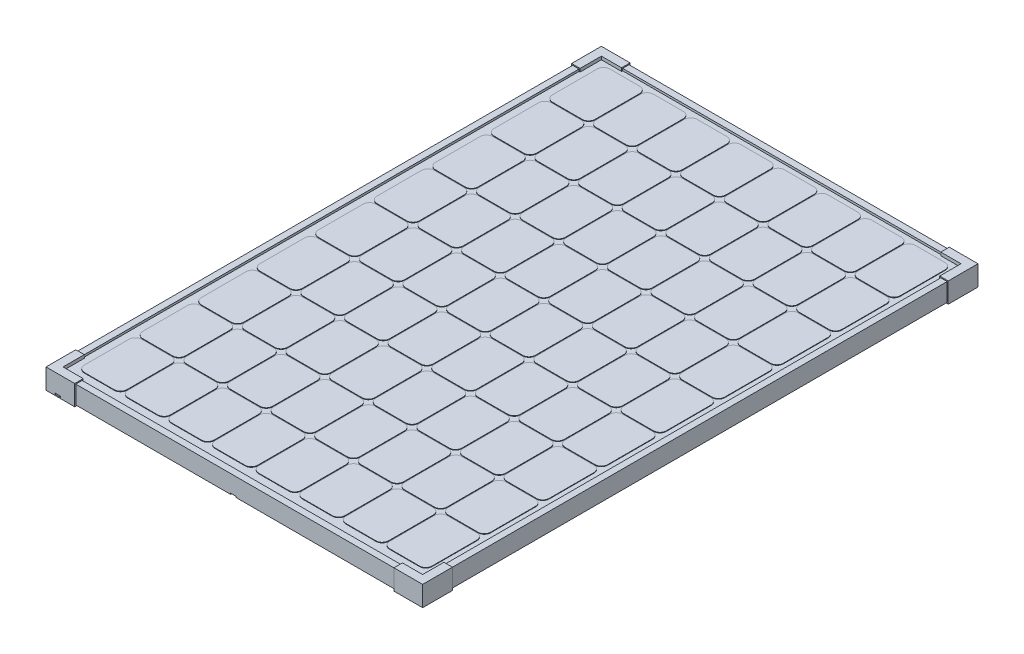
from build123d import *

# Parameters (mm, degrees)
CROQUIS1_W              = 352
CROQUIS1_H              = 520
SALIENTE_EXTRUIR1_DEPTH = 17
CROQUIS3_W              = 340
CROQUIS3_H              = 508
CORTAR_EXTRUIR1_DEPTH   = 2
VACIADO1_T              = -1
CROQUIS2_W              = 352
CROQUIS2_H              = 520
CROQUIS2_W_2            = 318
CROQUIS2_H_2            = 486
SALIENTE_EXTRUIR2_DEPTH = 1
SALIENTE_EXTRUIR3_START = -17
SALIENTE_EXTRUIR3_DEPTH = 18
SALIENTE_EXTRUIR4_DEPTH = 1
SIMETR_A2_START         = -17
SIMETR_A2_COPY_1_DEPTH  = 18
SIMETR_A2_COPY_2_DEPTH  = 1
CORTAR_EXTRUIR2_DEPTH   = 1
MATRIZL1_COUNT          = 2
MATRIZL1_PITCH          = 164
MATRIZL1_COUNT_DIR2     = 2
MATRIZL1_PITCH_DIR2     = 115
CROQUIS7_W              = 50
CROQUIS7_H              = 67
SALIENTE_EXTRUIR5_DEPTH = 14
REDONDEO1_R             = 3
SALIENTE_EXTRUIR6_DEPTH = 0.5


with BuildPart() as part:
    # Croquis1 → Saliente-Extruir1 (new body)
    with BuildSketch(Plane(origin=(0, 0, 0), x_dir=(1, 0, 0), z_dir=(0, 1, 0))):
        with Locations((176, 260)):
            Rectangle(CROQUIS1_W, CROQUIS1_H)
    extrude(amount=SALIENTE_EXTRUIR1_DEPTH)

    # Croquis3 → Cortar-Extruir1 (cut)
    with BuildSketch(Plane(origin=(0, 17, 0), x_dir=(1, 0, 0), z_dir=(0, 1, 0))):
        with Locations((176, 260)):
            Rectangle(CROQUIS3_W, CROQUIS3_H)
    extrude(amount=-CORTAR_EXTRUIR1_DEPTH, mode=Mode.SUBTRACT)

    # Vaciado1
    vaciado1_openings = [part.faces().sort_by_distance(p)[0] for p in [
        (176, 0, -260),
    ]]
    offset(amount=VACIADO1_T, openings=vaciado1_openings, kind=Kind.INTERSECTION)

    # Croquis2 → Saliente-Extruir2 (add)
    with BuildSketch(Plane.XZ):
        with Locations((176, -260)):
            Rectangle(CROQUIS2_W, CROQUIS2_H)
        with Locations((176, -260)):
            Rectangle(CROQUIS2_W_2, CROQUIS2_H_2, mode=Mode.SUBTRACT)
    extrude(amount=-SALIENTE_EXTRUIR2_DEPTH)

    # Croquis4 → Saliente-Extruir3 (add)
    with BuildSketch(Plane(origin=(0, 17, 0), x_dir=(1, 0, 0), z_dir=(0, 1, 0)).offset(SALIENTE_EXTRUIR3_START)):
        Polygon((26, 521), (-1, 521), (-1, 493), (7, 493), (7, 513), (26, 513), align=None)
    saliente_extruir3 = extrude(amount=SALIENTE_EXTRUIR3_DEPTH)

    # Croquis5 → Saliente-Extruir4 (add, symmetric)
    with BuildSketch(Plane.XZ):
        Polygon((-1, -521), (-1, -493), (18, -493), (18, -502), (26, -502), (26, -521), align=None)
    saliente_extruir4 = extrude(amount=SALIENTE_EXTRUIR4_DEPTH, both=True)

    # Simetría1: Saliente-Extruir3, Saliente-Extruir4 across plane
    add(saliente_extruir3.mirror(Plane.XY.offset(-260)))
    add(saliente_extruir4.mirror(Plane.XY.offset(-260)))

    # Simetría2: Saliente-Extruir3, Saliente-Extruir4 across plane
    add(saliente_extruir3.mirror(Plane.ZY.offset(-176)))
    add(saliente_extruir4.mirror(Plane.ZY.offset(-176)))

    # Simetría2 copy 1 sketch → Simetría2 copy 1 (add)
    with BuildSketch(Plane(origin=(352, 17, -520), x_dir=(-1, 0, 0), z_dir=(0, 1, 0)).offset(SIMETR_A2_START)):
        Polygon((26, 521), (-1, 521), (-1, 493), (7, 493), (7, 513), (26, 513), align=None)
    extrude(amount=SIMETR_A2_COPY_1_DEPTH)

    # Simetría2 copy 2 sketch → Simetría2 copy 2 (add, symmetric)
    with BuildSketch(Plane(origin=(352, 0, -520), x_dir=(-1, 0, 0), z_dir=(0, -1, 0))):
        Polygon((-1, -521), (-1, -493), (18, -493), (18, -502), (26, -502), (26, -521), align=None)
    extrude(amount=SIMETR_A2_COPY_2_DEPTH, both=True)

    # Croquis6 → Cortar-Extruir2 (cut)
    with BuildSketch(Plane.XZ):
        with BuildLine():
            Line((7.5, -646.40351795), (7.5, 241.40351795))
            ThreePointArc((7.5, 241.40351795), (10, 243.90351795), (12.5, 241.40351795))
            Line((12.5, 241.40351795), (12.5, -646.40351795))
            ThreePointArc((12.5, -646.40351795), (10, -648.90351795), (7.5, -646.40351795))
        make_face()
    cortar_extruir2 = extrude(amount=-CORTAR_EXTRUIR2_DEPTH, mode=Mode.SUBTRACT)

    # MatrizL1: Cortar-Extruir2 2 × 2
    with Locations(*[(i * MATRIZL1_PITCH, 0, -j * MATRIZL1_PITCH_DIR2) for i in range(MATRIZL1_COUNT) for j in range(MATRIZL1_COUNT_DIR2) if (i, j) != (0, 0)]):
        add(cortar_extruir2, mode=Mode.SUBTRACT)

    # Croquis7 → Saliente-Extruir5 (add)
    with BuildSketch(Plane.XZ.offset(-14)):
        with Locations((259.5, -59.5)):
            Rectangle(CROQUIS7_W, CROQUIS7_H)
    extrude(amount=SALIENTE_EXTRUIR5_DEPTH)

    # Redondeo1
    redondeo1_edges = [part.edges().sort_by_distance(p)[0] for p in [
        (284.5, 7, -93),
        (284.5, 7, -26),
        (234.5, 7, -26),
        (234.5, 7, -93),
    ]]
    fillet(redondeo1_edges, radius=REDONDEO1_R)

    # Croquis8 → Saliente-Extruir6 (add)
    with BuildSketch(Plane(origin=(0, 15, 0), x_dir=(1, 0, 0), z_dir=(0, 1, 0))):
        with BuildLine():
            Line((19, 509), (47, 509))
            ThreePointArc((47, 509), (51.242640687, 507.242640687), (53, 503))
            Line((53, 503), (53, 461))
            ThreePointArc((53, 461), (51.242640687, 456.757359313), (47, 455))
            Line((47, 455), (19, 455))
            ThreePointArc((19, 455), (14.757359313, 456.757359313), (13, 461))
            Line((13, 461), (13, 503))
            ThreePointArc((13, 503), (14.757359313, 507.242640687), (19, 509))
        make_face()
        with BuildLine():
            Line((60, 509), (88, 509))
            ThreePointArc((88, 509), (92.242640687, 507.242640687), (94, 503))
            Line((94, 503), (94, 461))
            ThreePointArc((94, 461), (92.242640687, 456.757359313), (88, 455))
            Line((88, 455), (60, 455))
            ThreePointArc((60, 455), (55.757359313, 456.757359313), (54, 461))
            Line((54, 461), (54, 503))
            ThreePointArc((54, 503), (55.757359313, 507.242640687), (60, 509))
        make_face()
        with BuildLine():
            Line((101, 509), (129, 509))
            ThreePointArc((129, 509), (133.242640687, 507.242640687), (135, 503))
            Line((135, 503), (135, 461))
            ThreePointArc((135, 461), (133.242640687, 456.757359313), (129, 455))
            Line((129, 455), (101, 455))
            ThreePointArc((101, 455), (96.757359313, 456.757359313), (95, 461))
            Line((95, 461), (95, 503))
            ThreePointArc((95, 503), (96.757359313, 507.242640687), (101, 509))
        make_face()
        with BuildLine():
            Line((142, 509), (170, 509))
            ThreePointArc((170, 509), (174.242640687, 507.242640687), (176, 503))
            Line((176, 503), (176, 461))
            ThreePointArc((176, 461), (174.242640687, 456.757359313), (170, 455))
            Line((170, 455), (142, 455))
            ThreePointArc((142, 455), (137.757359313, 456.757359313), (136, 461))
            Line((136, 461), (136, 503))
            ThreePointArc((136, 503), (137.757359313, 507.242640687), (142, 509))
        make_face()
        with BuildLine():
            Line((183, 509), (211, 509))
            ThreePointArc((211, 509), (215.242640687, 507.242640687), (217, 503))
            Line((217, 503), (217, 461))
            ThreePointArc((217, 461), (215.242640687, 456.757359313), (211, 455))
            Line((211, 455), (183, 455))
            ThreePointArc((183, 455), (178.757359313, 456.757359313), (177, 461))
            Line((177, 461), (177, 503))
            ThreePointArc((177, 503), (178.757359313, 507.242640687), (183, 509))
        make_face()
        with BuildLine():
            Line((224, 509), (252, 509))
            ThreePointArc((252, 509), (256.242640687, 507.242640687), (258, 503))
            Line((258, 503), (258, 461))
            ThreePointArc((258, 461), (256.242640687, 456.757359313), (252, 455))
            Line((252, 455), (224, 455))
            ThreePointArc((224, 455), (219.757359313, 456.757359313), (218, 461))
            Line((218, 461), (218, 503))
            ThreePointArc((218, 503), (219.757359313, 507.242640687), (224, 509))
        make_face()
        with BuildLine():
            Line((265, 509), (293, 509))
            ThreePointArc((293, 509), (297.242640687, 507.242640687), (299, 503))
            Line((299, 503), (299, 461))
            ThreePointArc((299, 461), (297.242640687, 456.757359313), (293, 455))
            Line((293, 455), (265, 455))
            ThreePointArc((265, 455), (260.757359313, 456.757359313), (259, 461))
            Line((259, 461), (259, 503))
            ThreePointArc((259, 503), (260.757359313, 507.242640687), (265, 509))
        make_face()
        with BuildLine():
            Line((306, 509), (334, 509))
            ThreePointArc((334, 509), (338.242640687, 507.242640687), (340, 503))
            Line((340, 503), (340, 461))
            ThreePointArc((340, 461), (338.242640687, 456.757359313), (334, 455))
            Line((334, 455), (306, 455))
            ThreePointArc((306, 455), (301.757359313, 456.757359313), (300, 461))
            Line((300, 461), (300, 503))
            ThreePointArc((300, 503), (301.757359313, 507.242640687), (306, 509))
        make_face()
        with BuildLine():
            Line((60, 454), (88, 454))
            ThreePointArc((88, 454), (92.242640687, 452.242640687), (94, 448))
            Line((94, 448), (94, 406))
            ThreePointArc((94, 406), (92.242640687, 401.757359313), (88, 400))
            Line((88, 400), (60, 400))
            ThreePointArc((60, 400), (55.757359313, 401.757359313), (54, 406))
            Line((54, 406), (54, 448))
            ThreePointArc((54, 448), (55.757359313, 452.242640687), (60, 454))
        make_face()
        with BuildLine():
            Line((101, 454), (129, 454))
            ThreePointArc((129, 454), (133.242640687, 452.242640687), (135, 448))
            Line((135, 448), (135, 406))
            ThreePointArc((135, 406), (133.242640687, 401.757359313), (129, 400))
            Line((129, 400), (101, 400))
            ThreePointArc((101, 400), (96.757359313, 401.757359313), (95, 406))
            Line((95, 406), (95, 448))
            ThreePointArc((95, 448), (96.757359313, 452.242640687), (101, 454))
        make_face()
        with BuildLine():
            Line((142, 454), (170, 454))
            ThreePointArc((170, 454), (174.242640687, 452.242640687), (176, 448))
            Line((176, 448), (176, 406))
            ThreePointArc((176, 406), (174.242640687, 401.757359313), (170, 400))
            Line((170, 400), (142, 400))
            ThreePointArc((142, 400), (137.757359313, 401.757359313), (136, 406))
            Line((136, 406), (136, 448))
            ThreePointArc((136, 448), (137.757359313, 452.242640687), (142, 454))
        make_face()
        with BuildLine():
            Line((183, 454), (211, 454))
            ThreePointArc((211, 454), (215.242640687, 452.242640687), (217, 448))
            Line((217, 448), (217, 406))
            ThreePointArc((217, 406), (215.242640687, 401.757359313), (211, 400))
            Line((211, 400), (183, 400))
            ThreePointArc((183, 400), (178.757359313, 401.757359313), (177, 406))
            Line((177, 406), (177, 448))
            ThreePointArc((177, 448), (178.757359313, 452.242640687), (183, 454))
        make_face()
        with BuildLine():
            Line((224, 454), (252, 454))
            ThreePointArc((252, 454), (256.242640687, 452.242640687), (258, 448))
            Line((258, 448), (258, 406))
            ThreePointArc((258, 406), (256.242640687, 401.757359313), (252, 400))
            Line((252, 400), (224, 400))
            ThreePointArc((224, 400), (219.757359313, 401.757359313), (218, 406))
            Line((218, 406), (218, 448))
            ThreePointArc((218, 448), (219.757359313, 452.242640687), (224, 454))
        make_face()
        with BuildLine():
            Line((265, 454), (293, 454))
            ThreePointArc((293, 454), (297.242640687, 452.242640687), (299, 448))
            Line((299, 448), (299, 406))
            ThreePointArc((299, 406), (297.242640687, 401.757359313), (293, 400))
            Line((293, 400), (265, 400))
            ThreePointArc((265, 400), (260.757359313, 401.757359313), (259, 406))
            Line((259, 406), (259, 448))
            ThreePointArc((259, 448), (260.757359313, 452.242640687), (265, 454))
        make_face()
        with BuildLine():
            Line((306, 454), (334, 454))
            ThreePointArc((334, 454), (338.242640687, 452.242640687), (340, 448))
            Line((340, 448), (340, 406))
            ThreePointArc((340, 406), (338.242640687, 401.757359313), (334, 400))
            Line((334, 400), (306, 400))
            ThreePointArc((306, 400), (301.757359313, 401.757359313), (300, 406))
            Line((300, 406), (300, 448))
            ThreePointArc((300, 448), (301.757359313, 452.242640687), (306, 454))
        make_face()
        with BuildLine():
            Line((60, 399), (88, 399))
            ThreePointArc((88, 399), (92.242640687, 397.242640687), (94, 393))
            Line((94, 393), (94, 351))
            ThreePointArc((94, 351), (92.242640687, 346.757359313), (88, 345))
            Line((88, 345), (60, 345))
            ThreePointArc((60, 345), (55.757359313, 346.757359313), (54, 351))
            Line((54, 351), (54, 393))
            ThreePointArc((54, 393), (55.757359313, 397.242640687), (60, 399))
        make_face()
        with BuildLine():
            Line((101, 399), (129, 399))
            ThreePointArc((129, 399), (133.242640687, 397.242640687), (135, 393))
            Line((135, 393), (135, 351))
            ThreePointArc((135, 351), (133.242640687, 346.757359313), (129, 345))
            Line((129, 345), (101, 345))
            ThreePointArc((101, 345), (96.757359313, 346.757359313), (95, 351))
            Line((95, 351), (95, 393))
            ThreePointArc((95, 393), (96.757359313, 397.242640687), (101, 399))
        make_face()
        with BuildLine():
            Line((142, 399), (170, 399))
            ThreePointArc((170, 399), (174.242640687, 397.242640687), (176, 393))
            Line((176, 393), (176, 351))
            ThreePointArc((176, 351), (174.242640687, 346.757359313), (170, 345))
            Line((170, 345), (142, 345))
            ThreePointArc((142, 345), (137.757359313, 346.757359313), (136, 351))
            Line((136, 351), (136, 393))
            ThreePointArc((136, 393), (137.757359313, 397.242640687), (142, 399))
        make_face()
        with BuildLine():
            Line((183, 399), (211, 399))
            ThreePointArc((211, 399), (215.242640687, 397.242640687), (217, 393))
            Line((217, 393), (217, 351))
            ThreePointArc((217, 351), (215.242640687, 346.757359313), (211, 345))
            Line((211, 345), (183, 345))
            ThreePointArc((183, 345), (178.757359313, 346.757359313), (177, 351))
            Line((177, 351), (177, 393))
            ThreePointArc((177, 393), (178.757359313, 397.242640687), (183, 399))
        make_face()
        with BuildLine():
            Line((224, 399), (252, 399))
            ThreePointArc((252, 399), (256.242640687, 397.242640687), (258, 393))
            Line((258, 393), (258, 351))
            ThreePointArc((258, 351), (256.242640687, 346.757359313), (252, 345))
            Line((252, 345), (224, 345))
            ThreePointArc((224, 345), (219.757359313, 346.757359313), (218, 351))
            Line((218, 351), (218, 393))
            ThreePointArc((218, 393), (219.757359313, 397.242640687), (224, 399))
        make_face()
        with BuildLine():
            Line((265, 399), (293, 399))
            ThreePointArc((293, 399), (297.242640687, 397.242640687), (299, 393))
            Line((299, 393), (299, 351))
            ThreePointArc((299, 351), (297.242640687, 346.757359313), (293, 345))
            Line((293, 345), (265, 345))
            ThreePointArc((265, 345), (260.757359313, 346.757359313), (259, 351))
            Line((259, 351), (259, 393))
            ThreePointArc((259, 393), (260.757359313, 397.242640687), (265, 399))
        make_face()
        with BuildLine():
            Line((306, 399), (334, 399))
            ThreePointArc((334, 399), (338.242640687, 397.242640687), (340, 393))
            Line((340, 393), (340, 351))
            ThreePointArc((340, 351), (338.242640687, 346.757359313), (334, 345))
            Line((334, 345), (306, 345))
            ThreePointArc((306, 345), (301.757359313, 346.757359313), (300, 351))
            Line((300, 351), (300, 393))
            ThreePointArc((300, 393), (301.757359313, 397.242640687), (306, 399))
        make_face()
        with BuildLine():
            Line((60, 344), (88, 344))
            ThreePointArc((88, 344), (92.242640687, 342.242640687), (94, 338))
            Line((94, 338), (94, 296))
            ThreePointArc((94, 296), (92.242640687, 291.757359313), (88, 290))
            Line((88, 290), (60, 290))
            ThreePointArc((60, 290), (55.757359313, 291.757359313), (54, 296))
            Line((54, 296), (54, 338))
            ThreePointArc((54, 338), (55.757359313, 342.242640687), (60, 344))
        make_face()
        with BuildLine():
            Line((101, 344), (129, 344))
            ThreePointArc((129, 344), (133.242640687, 342.242640687), (135, 338))
            Line((135, 338), (135, 296))
            ThreePointArc((135, 296), (133.242640687, 291.757359313), (129, 290))
            Line((129, 290), (101, 290))
            ThreePointArc((101, 290), (96.757359313, 291.757359313), (95, 296))
            Line((95, 296), (95, 338))
            ThreePointArc((95, 338), (96.757359313, 342.242640687), (101, 344))
        make_face()
        with BuildLine():
            Line((142, 344), (170, 344))
            ThreePointArc((170, 344), (174.242640687, 342.242640687), (176, 338))
            Line((176, 338), (176, 296))
            ThreePointArc((176, 296), (174.242640687, 291.757359313), (170, 290))
            Line((170, 290), (142, 290))
            ThreePointArc((142, 290), (137.757359313, 291.757359313), (136, 296))
            Line((136, 296), (136, 338))
            ThreePointArc((136, 338), (137.757359313, 342.242640687), (142, 344))
        make_face()
        with BuildLine():
            Line((183, 344), (211, 344))
            ThreePointArc((211, 344), (215.242640687, 342.242640687), (217, 338))
            Line((217, 338), (217, 296))
            ThreePointArc((217, 296), (215.242640687, 291.757359313), (211, 290))
            Line((211, 290), (183, 290))
            ThreePointArc((183, 290), (178.757359313, 291.757359313), (177, 296))
            Line((177, 296), (177, 338))
            ThreePointArc((177, 338), (178.757359313, 342.242640687), (183, 344))
        make_face()
        with BuildLine():
            Line((224, 344), (252, 344))
            ThreePointArc((252, 344), (256.242640687, 342.242640687), (258, 338))
            Line((258, 338), (258, 296))
            ThreePointArc((258, 296), (256.242640687, 291.757359313), (252, 290))
            Line((252, 290), (224, 290))
            ThreePointArc((224, 290), (219.757359313, 291.757359313), (218, 296))
            Line((218, 296), (218, 338))
            ThreePointArc((218, 338), (219.757359313, 342.242640687), (224, 344))
        make_face()
        with BuildLine():
            Line((265, 344), (293, 344))
            ThreePointArc((293, 344), (297.242640687, 342.242640687), (299, 338))
            Line((299, 338), (299, 296))
            ThreePointArc((299, 296), (297.242640687, 291.757359313), (293, 290))
            Line((293, 290), (265, 290))
            ThreePointArc((265, 290), (260.757359313, 291.757359313), (259, 296))
            Line((259, 296), (259, 338))
            ThreePointArc((259, 338), (260.757359313, 342.242640687), (265, 344))
        make_face()
        with BuildLine():
            Line((306, 344), (334, 344))
            ThreePointArc((334, 344), (338.242640687, 342.242640687), (340, 338))
            Line((340, 338), (340, 296))
            ThreePointArc((340, 296), (338.242640687, 291.757359313), (334, 290))
            Line((334, 290), (306, 290))
            ThreePointArc((306, 290), (301.757359313, 291.757359313), (300, 296))
            Line((300, 296), (300, 338))
            ThreePointArc((300, 338), (301.757359313, 342.242640687), (306, 344))
        make_face()
        with BuildLine():
            Line((60, 289), (88, 289))
            ThreePointArc((88, 289), (92.242640687, 287.242640687), (94, 283))
            Line((94, 283), (94, 241))
            ThreePointArc((94, 241), (92.242640687, 236.757359313), (88, 235))
            Line((88, 235), (60, 235))
            ThreePointArc((60, 235), (55.757359313, 236.757359313), (54, 241))
            Line((54, 241), (54, 283))
            ThreePointArc((54, 283), (55.757359313, 287.242640687), (60, 289))
        make_face()
        with BuildLine():
            Line((101, 289), (129, 289))
            ThreePointArc((129, 289), (133.242640687, 287.242640687), (135, 283))
            Line((135, 283), (135, 241))
            ThreePointArc((135, 241), (133.242640687, 236.757359313), (129, 235))
            Line((129, 235), (101, 235))
            ThreePointArc((101, 235), (96.757359313, 236.757359313), (95, 241))
            Line((95, 241), (95, 283))
            ThreePointArc((95, 283), (96.757359313, 287.242640687), (101, 289))
        make_face()
        with BuildLine():
            Line((142, 289), (170, 289))
            ThreePointArc((170, 289), (174.242640687, 287.242640687), (176, 283))
            Line((176, 283), (176, 241))
            ThreePointArc((176, 241), (174.242640687, 236.757359313), (170, 235))
            Line((170, 235), (142, 235))
            ThreePointArc((142, 235), (137.757359313, 236.757359313), (136, 241))
            Line((136, 241), (136, 283))
            ThreePointArc((136, 283), (137.757359313, 287.242640687), (142, 289))
        make_face()
        with BuildLine():
            Line((183, 289), (211, 289))
            ThreePointArc((211, 289), (215.242640687, 287.242640687), (217, 283))
            Line((217, 283), (217, 241))
            ThreePointArc((217, 241), (215.242640687, 236.757359313), (211, 235))
            Line((211, 235), (183, 235))
            ThreePointArc((183, 235), (178.757359313, 236.757359313), (177, 241))
            Line((177, 241), (177, 283))
            ThreePointArc((177, 283), (178.757359313, 287.242640687), (183, 289))
        make_face()
        with BuildLine():
            Line((224, 289), (252, 289))
            ThreePointArc((252, 289), (256.242640687, 287.242640687), (258, 283))
            Line((258, 283), (258, 241))
            ThreePointArc((258, 241), (256.242640687, 236.757359313), (252, 235))
            Line((252, 235), (224, 235))
            ThreePointArc((224, 235), (219.757359313, 236.757359313), (218, 241))
            Line((218, 241), (218, 283))
            ThreePointArc((218, 283), (219.757359313, 287.242640687), (224, 289))
        make_face()
        with BuildLine():
            Line((265, 289), (293, 289))
            ThreePointArc((293, 289), (297.242640687, 287.242640687), (299, 283))
            Line((299, 283), (299, 241))
            ThreePointArc((299, 241), (297.242640687, 236.757359313), (293, 235))
            Line((293, 235), (265, 235))
            ThreePointArc((265, 235), (260.757359313, 236.757359313), (259, 241))
            Line((259, 241), (259, 283))
            ThreePointArc((259, 283), (260.757359313, 287.242640687), (265, 289))
        make_face()
        with BuildLine():
            Line((306, 289), (334, 289))
            ThreePointArc((334, 289), (338.242640687, 287.242640687), (340, 283))
            Line((340, 283), (340, 241))
            ThreePointArc((340, 241), (338.242640687, 236.757359313), (334, 235))
            Line((334, 235), (306, 235))
            ThreePointArc((306, 235), (301.757359313, 236.757359313), (300, 241))
            Line((300, 241), (300, 283))
            ThreePointArc((300, 283), (301.757359313, 287.242640687), (306, 289))
        make_face()
        with BuildLine():
            Line((60, 234), (88, 234))
            ThreePointArc((88, 234), (92.242640687, 232.242640687), (94, 228))
            Line((94, 228), (94, 186))
            ThreePointArc((94, 186), (92.242640687, 181.757359313), (88, 180))
            Line((88, 180), (60, 180))
            ThreePointArc((60, 180), (55.757359313, 181.757359313), (54, 186))
            Line((54, 186), (54, 228))
            ThreePointArc((54, 228), (55.757359313, 232.242640687), (60, 234))
        make_face()
        with BuildLine():
            Line((101, 234), (129, 234))
            ThreePointArc((129, 234), (133.242640687, 232.242640687), (135, 228))
            Line((135, 228), (135, 186))
            ThreePointArc((135, 186), (133.242640687, 181.757359313), (129, 180))
            Line((129, 180), (101, 180))
            ThreePointArc((101, 180), (96.757359313, 181.757359313), (95, 186))
            Line((95, 186), (95, 228))
            ThreePointArc((95, 228), (96.757359313, 232.242640687), (101, 234))
        make_face()
        with BuildLine():
            Line((142, 234), (170, 234))
            ThreePointArc((170, 234), (174.242640687, 232.242640687), (176, 228))
            Line((176, 228), (176, 186))
            ThreePointArc((176, 186), (174.242640687, 181.757359313), (170, 180))
            Line((170, 180), (142, 180))
            ThreePointArc((142, 180), (137.757359313, 181.757359313), (136, 186))
            Line((136, 186), (136, 228))
            ThreePointArc((136, 228), (137.757359313, 232.242640687), (142, 234))
        make_face()
        with BuildLine():
            Line((183, 234), (211, 234))
            ThreePointArc((211, 234), (215.242640687, 232.242640687), (217, 228))
            Line((217, 228), (217, 186))
            ThreePointArc((217, 186), (215.242640687, 181.757359313), (211, 180))
            Line((211, 180), (183, 180))
            ThreePointArc((183, 180), (178.757359313, 181.757359313), (177, 186))
            Line((177, 186), (177, 228))
            ThreePointArc((177, 228), (178.757359313, 232.242640687), (183, 234))
        make_face()
        with BuildLine():
            Line((224, 234), (252, 234))
            ThreePointArc((252, 234), (256.242640687, 232.242640687), (258, 228))
            Line((258, 228), (258, 186))
            ThreePointArc((258, 186), (256.242640687, 181.757359313), (252, 180))
            Line((252, 180), (224, 180))
            ThreePointArc((224, 180), (219.757359313, 181.757359313), (218, 186))
            Line((218, 186), (218, 228))
            ThreePointArc((218, 228), (219.757359313, 232.242640687), (224, 234))
        make_face()
        with BuildLine():
            Line((265, 234), (293, 234))
            ThreePointArc((293, 234), (297.242640687, 232.242640687), (299, 228))
            Line((299, 228), (299, 186))
            ThreePointArc((299, 186), (297.242640687, 181.757359313), (293, 180))
            Line((293, 180), (265, 180))
            ThreePointArc((265, 180), (260.757359313, 181.757359313), (259, 186))
            Line((259, 186), (259, 228))
            ThreePointArc((259, 228), (260.757359313, 232.242640687), (265, 234))
        make_face()
        with BuildLine():
            Line((306, 234), (334, 234))
            ThreePointArc((334, 234), (338.242640687, 232.242640687), (340, 228))
            Line((340, 228), (340, 186))
            ThreePointArc((340, 186), (338.242640687, 181.757359313), (334, 180))
            Line((334, 180), (306, 180))
            ThreePointArc((306, 180), (301.757359313, 181.757359313), (300, 186))
            Line((300, 186), (300, 228))
            ThreePointArc((300, 228), (301.757359313, 232.242640687), (306, 234))
        make_face()
        with BuildLine():
            Line((60, 179), (88, 179))
            ThreePointArc((88, 179), (92.242640687, 177.242640687), (94, 173))
            Line((94, 173), (94, 131))
            ThreePointArc((94, 131), (92.242640687, 126.757359313), (88, 125))
            Line((88, 125), (60, 125))
            ThreePointArc((60, 125), (55.757359313, 126.757359313), (54, 131))
            Line((54, 131), (54, 173))
            ThreePointArc((54, 173), (55.757359313, 177.242640687), (60, 179))
        make_face()
        with BuildLine():
            Line((101, 179), (129, 179))
            ThreePointArc((129, 179), (133.242640687, 177.242640687), (135, 173))
            Line((135, 173), (135, 131))
            ThreePointArc((135, 131), (133.242640687, 126.757359313), (129, 125))
            Line((129, 125), (101, 125))
            ThreePointArc((101, 125), (96.757359313, 126.757359313), (95, 131))
            Line((95, 131), (95, 173))
            ThreePointArc((95, 173), (96.757359313, 177.242640687), (101, 179))
        make_face()
        with BuildLine():
            Line((142, 179), (170, 179))
            ThreePointArc((170, 179), (174.242640687, 177.242640687), (176, 173))
            Line((176, 173), (176, 131))
            ThreePointArc((176, 131), (174.242640687, 126.757359313), (170, 125))
            Line((170, 125), (142, 125))
            ThreePointArc((142, 125), (137.757359313, 126.757359313), (136, 131))
            Line((136, 131), (136, 173))
            ThreePointArc((136, 173), (137.757359313, 177.242640687), (142, 179))
        make_face()
        with BuildLine():
            Line((183, 179), (211, 179))
            ThreePointArc((211, 179), (215.242640687, 177.242640687), (217, 173))
            Line((217, 173), (217, 131))
            ThreePointArc((217, 131), (215.242640687, 126.757359313), (211, 125))
            Line((211, 125), (183, 125))
            ThreePointArc((183, 125), (178.757359313, 126.757359313), (177, 131))
            Line((177, 131), (177, 173))
            ThreePointArc((177, 173), (178.757359313, 177.242640687), (183, 179))
        make_face()
        with BuildLine():
            Line((224, 179), (252, 179))
            ThreePointArc((252, 179), (256.242640687, 177.242640687), (258, 173))
            Line((258, 173), (258, 131))
            ThreePointArc((258, 131), (256.242640687, 126.757359313), (252, 125))
            Line((252, 125), (224, 125))
            ThreePointArc((224, 125), (219.757359313, 126.757359313), (218, 131))
            Line((218, 131), (218, 173))
            ThreePointArc((218, 173), (219.757359313, 177.242640687), (224, 179))
        make_face()
        with BuildLine():
            Line((265, 179), (293, 179))
            ThreePointArc((293, 179), (297.242640687, 177.242640687), (299, 173))
            Line((299, 173), (299, 131))
            ThreePointArc((299, 131), (297.242640687, 126.757359313), (293, 125))
            Line((293, 125), (265, 125))
            ThreePointArc((265, 125), (260.757359313, 126.757359313), (259, 131))
            Line((259, 131), (259, 173))
            ThreePointArc((259, 173), (260.757359313, 177.242640687), (265, 179))
        make_face()
        with BuildLine():
            Line((306, 179), (334, 179))
            ThreePointArc((334, 179), (338.242640687, 177.242640687), (340, 173))
            Line((340, 173), (340, 131))
            ThreePointArc((340, 131), (338.242640687, 126.757359313), (334, 125))
            Line((334, 125), (306, 125))
            ThreePointArc((306, 125), (301.757359313, 126.757359313), (300, 131))
            Line((300, 131), (300, 173))
            ThreePointArc((300, 173), (301.757359313, 177.242640687), (306, 179))
        make_face()
        with BuildLine():
            Line((60, 124), (88, 124))
            ThreePointArc((88, 124), (92.242640687, 122.242640687), (94, 118))
            Line((94, 118), (94, 76))
            ThreePointArc((94, 76), (92.242640687, 71.757359313), (88, 70))
            Line((88, 70), (60, 70))
            ThreePointArc((60, 70), (55.757359313, 71.757359313), (54, 76))
            Line((54, 76), (54, 118))
            ThreePointArc((54, 118), (55.757359313, 122.242640687), (60, 124))
        make_face()
        with BuildLine():
            Line((101, 124), (129, 124))
            ThreePointArc((129, 124), (133.242640687, 122.242640687), (135, 118))
            Line((135, 118), (135, 76))
            ThreePointArc((135, 76), (133.242640687, 71.757359313), (129, 70))
            Line((129, 70), (101, 70))
            ThreePointArc((101, 70), (96.757359313, 71.757359313), (95, 76))
            Line((95, 76), (95, 118))
            ThreePointArc((95, 118), (96.757359313, 122.242640687), (101, 124))
        make_face()
        with BuildLine():
            Line((142, 124), (170, 124))
            ThreePointArc((170, 124), (174.242640687, 122.242640687), (176, 118))
            Line((176, 118), (176, 76))
            ThreePointArc((176, 76), (174.242640687, 71.757359313), (170, 70))
            Line((170, 70), (142, 70))
            ThreePointArc((142, 70), (137.757359313, 71.757359313), (136, 76))
            Line((136, 76), (136, 118))
            ThreePointArc((136, 118), (137.757359313, 122.242640687), (142, 124))
        make_face()
        with BuildLine():
            Line((183, 124), (211, 124))
            ThreePointArc((211, 124), (215.242640687, 122.242640687), (217, 118))
            Line((217, 118), (217, 76))
            ThreePointArc((217, 76), (215.242640687, 71.757359313), (211, 70))
            Line((211, 70), (183, 70))
            ThreePointArc((183, 70), (178.757359313, 71.757359313), (177, 76))
            Line((177, 76), (177, 118))
            ThreePointArc((177, 118), (178.757359313, 122.242640687), (183, 124))
        make_face()
        with BuildLine():
            Line((224, 124), (252, 124))
            ThreePointArc((252, 124), (256.242640687, 122.242640687), (258, 118))
            Line((258, 118), (258, 76))
            ThreePointArc((258, 76), (256.242640687, 71.757359313), (252, 70))
            Line((252, 70), (224, 70))
            ThreePointArc((224, 70), (219.757359313, 71.757359313), (218, 76))
            Line((218, 76), (218, 118))
            ThreePointArc((218, 118), (219.757359313, 122.242640687), (224, 124))
        make_face()
        with BuildLine():
            Line((265, 124), (293, 124))
            ThreePointArc((293, 124), (297.242640687, 122.242640687), (299, 118))
            Line((299, 118), (299, 76))
            ThreePointArc((299, 76), (297.242640687, 71.757359313), (293, 70))
            Line((293, 70), (265, 70))
            ThreePointArc((265, 70), (260.757359313, 71.757359313), (259, 76))
            Line((259, 76), (259, 118))
            ThreePointArc((259, 118), (260.757359313, 122.242640687), (265, 124))
        make_face()
        with BuildLine():
            Line((306, 124), (334, 124))
            ThreePointArc((334, 124), (338.242640687, 122.242640687), (340, 118))
            Line((340, 118), (340, 76))
            ThreePointArc((340, 76), (338.242640687, 71.757359313), (334, 70))
            Line((334, 70), (306, 70))
            ThreePointArc((306, 70), (301.757359313, 71.757359313), (300, 76))
            Line((300, 76), (300, 118))
            ThreePointArc((300, 118), (301.757359313, 122.242640687), (306, 124))
        make_face()
        with BuildLine():
            Line((60, 69), (88, 69))
            ThreePointArc((88, 69), (92.242640687, 67.242640687), (94, 63))
            Line((94, 63), (94, 21))
            ThreePointArc((94, 21), (92.242640687, 16.757359313), (88, 15))
            Line((88, 15), (60, 15))
            ThreePointArc((60, 15), (55.757359313, 16.757359313), (54, 21))
            Line((54, 21), (54, 63))
            ThreePointArc((54, 63), (55.757359313, 67.242640687), (60, 69))
        make_face()
        with BuildLine():
            Line((101, 69), (129, 69))
            ThreePointArc((129, 69), (133.242640687, 67.242640687), (135, 63))
            Line((135, 63), (135, 21))
            ThreePointArc((135, 21), (133.242640687, 16.757359313), (129, 15))
            Line((129, 15), (101, 15))
            ThreePointArc((101, 15), (96.757359313, 16.757359313), (95, 21))
            Line((95, 21), (95, 63))
            ThreePointArc((95, 63), (96.757359313, 67.242640687), (101, 69))
        make_face()
        with BuildLine():
            Line((142, 69), (170, 69))
            ThreePointArc((170, 69), (174.242640687, 67.242640687), (176, 63))
            Line((176, 63), (176, 21))
            ThreePointArc((176, 21), (174.242640687, 16.757359313), (170, 15))
            Line((170, 15), (142, 15))
            ThreePointArc((142, 15), (137.757359313, 16.757359313), (136, 21))
            Line((136, 21), (136, 63))
            ThreePointArc((136, 63), (137.757359313, 67.242640687), (142, 69))
        make_face()
        with BuildLine():
            Line((183, 69), (211, 69))
            ThreePointArc((211, 69), (215.242640687, 67.242640687), (217, 63))
            Line((217, 63), (217, 21))
            ThreePointArc((217, 21), (215.242640687, 16.757359313), (211, 15))
            Line((211, 15), (183, 15))
            ThreePointArc((183, 15), (178.757359313, 16.757359313), (177, 21))
            Line((177, 21), (177, 63))
            ThreePointArc((177, 63), (178.757359313, 67.242640687), (183, 69))
        make_face()
        with BuildLine():
            Line((224, 69), (252, 69))
            ThreePointArc((252, 69), (256.242640687, 67.242640687), (258, 63))
            Line((258, 63), (258, 21))
            ThreePointArc((258, 21), (256.242640687, 16.757359313), (252, 15))
            Line((252, 15), (224, 15))
            ThreePointArc((224, 15), (219.757359313, 16.757359313), (218, 21))
            Line((218, 21), (218, 63))
            ThreePointArc((218, 63), (219.757359313, 67.242640687), (224, 69))
        make_face()
        with BuildLine():
            Line((265, 69), (293, 69))
            ThreePointArc((293, 69), (297.242640687, 67.242640687), (299, 63))
            Line((299, 63), (299, 21))
            ThreePointArc((299, 21), (297.242640687, 16.757359313), (293, 15))
            Line((293, 15), (265, 15))
            ThreePointArc((265, 15), (260.757359313, 16.757359313), (259, 21))
            Line((259, 21), (259, 63))
            ThreePointArc((259, 63), (260.757359313, 67.242640687), (265, 69))
        make_face()
        with BuildLine():
            Line((306, 69), (334, 69))
            ThreePointArc((334, 69), (338.242640687, 67.242640687), (340, 63))
            Line((340, 63), (340, 21))
            ThreePointArc((340, 21), (338.242640687, 16.757359313), (334, 15))
            Line((334, 15), (306, 15))
            ThreePointArc((306, 15), (301.757359313, 16.757359313), (300, 21))
            Line((300, 21), (300, 63))
            ThreePointArc((300, 63), (301.757359313, 67.242640687), (306, 69))
        make_face()
        with BuildLine():
            Line((19, 454), (47, 454))
            ThreePointArc((47, 454), (51.242640687, 452.242640687), (53, 448))
            Line((53, 448), (53, 406))
            ThreePointArc((53, 406), (51.242640687, 401.757359313), (47, 400))
            Line((47, 400), (19, 400))
            ThreePointArc((19, 400), (14.757359313, 401.757359313), (13, 406))
            Line((13, 406), (13, 448))
            ThreePointArc((13, 448), (14.757359313, 452.242640687), (19, 454))
        make_face()
        with BuildLine():
            Line((19, 399), (47, 399))
            ThreePointArc((47, 399), (51.242640687, 397.242640687), (53, 393))
            Line((53, 393), (53, 351))
            ThreePointArc((53, 351), (51.242640687, 346.757359313), (47, 345))
            Line((47, 345), (19, 345))
            ThreePointArc((19, 345), (14.757359313, 346.757359313), (13, 351))
            Line((13, 351), (13, 393))
            ThreePointArc((13, 393), (14.757359313, 397.242640687), (19, 399))
        make_face()
        with BuildLine():
            Line((19, 344), (47, 344))
            ThreePointArc((47, 344), (51.242640687, 342.242640687), (53, 338))
            Line((53, 338), (53, 296))
            ThreePointArc((53, 296), (51.242640687, 291.757359313), (47, 290))
            Line((47, 290), (19, 290))
            ThreePointArc((19, 290), (14.757359313, 291.757359313), (13, 296))
            Line((13, 296), (13, 338))
            ThreePointArc((13, 338), (14.757359313, 342.242640687), (19, 344))
        make_face()
        with BuildLine():
            Line((19, 289), (47, 289))
            ThreePointArc((47, 289), (51.242640687, 287.242640687), (53, 283))
            Line((53, 283), (53, 241))
            ThreePointArc((53, 241), (51.242640687, 236.757359313), (47, 235))
            Line((47, 235), (19, 235))
            ThreePointArc((19, 235), (14.757359313, 236.757359313), (13, 241))
            Line((13, 241), (13, 283))
            ThreePointArc((13, 283), (14.757359313, 287.242640687), (19, 289))
        make_face()
        with BuildLine():
            Line((19, 234), (47, 234))
            ThreePointArc((47, 234), (51.242640687, 232.242640687), (53, 228))
            Line((53, 228), (53, 186))
            ThreePointArc((53, 186), (51.242640687, 181.757359313), (47, 180))
            Line((47, 180), (19, 180))
            ThreePointArc((19, 180), (14.757359313, 181.757359313), (13, 186))
            Line((13, 186), (13, 228))
            ThreePointArc((13, 228), (14.757359313, 232.242640687), (19, 234))
        make_face()
        with BuildLine():
            Line((19, 179), (47, 179))
            ThreePointArc((47, 179), (51.242640687, 177.242640687), (53, 173))
            Line((53, 173), (53, 131))
            ThreePointArc((53, 131), (51.242640687, 126.757359313), (47, 125))
            Line((47, 125), (19, 125))
            ThreePointArc((19, 125), (14.757359313, 126.757359313), (13, 131))
            Line((13, 131), (13, 173))
            ThreePointArc((13, 173), (14.757359313, 177.242640687), (19, 179))
        make_face()
        with BuildLine():
            Line((19, 124), (47, 124))
            ThreePointArc((47, 124), (51.242640687, 122.242640687), (53, 118))
            Line((53, 118), (53, 76))
            ThreePointArc((53, 76), (51.242640687, 71.757359313), (47, 70))
            Line((47, 70), (19, 70))
            ThreePointArc((19, 70), (14.757359313, 71.757359313), (13, 76))
            Line((13, 76), (13, 118))
            ThreePointArc((13, 118), (14.757359313, 122.242640687), (19, 124))
        make_face()
        with BuildLine():
            Line((19, 69), (47, 69))
            ThreePointArc((47, 69), (51.242640687, 67.242640687), (53, 63))
            Line((53, 63), (53, 21))
            ThreePointArc((53, 21), (51.242640687, 16.757359313), (47, 15))
            Line((47, 15), (19, 15))
            ThreePointArc((19, 15), (14.757359313, 16.757359313), (13, 21))
            Line((13, 21), (13, 63))
            ThreePointArc((13, 63), (14.757359313, 67.242640687), (19, 69))
        make_face()
    extrude(amount=SALIENTE_EXTRUIR6_DEPTH)


solid = part.part
